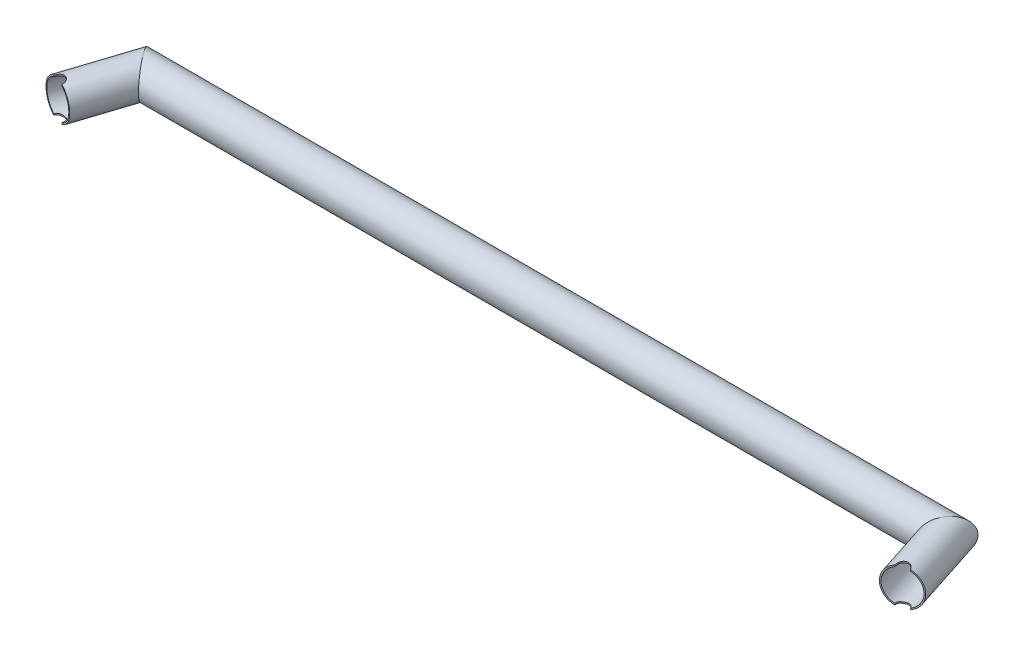
from build123d import *

# Parameters (mm, degrees)
SKETCH2_R               = 10.5
SKETCH2_R_2             = 9.75
CUT_EXTRUDE1_DEPTH      = 255.202518271
CUT_EXTRUDE1_DEPTH_BACK = 255.202518271
SKETCH3_R               = 3.5


with BuildPart() as part:
    # Sweep1: sweep along a path in Sketch1
    with BuildLine(Plane(origin=(0, 0, 0), x_dir=(1, 0, 0), z_dir=(0, 1, 0))) as sweep1_path:
        Line((-240.81, -36.88), (-228.826961603, 0))
        Line((-228.826961603, 0), (228.826961603, 0))
        Line((228.826961603, 0), (240.81, -36.88))
    # Sketch2 → Sweep1 (sweep)
    with BuildSketch(Plane(origin=(-240.81, 0, 36.88), x_dir=(0.9510565162951523, 0, 0.3090169943749515), z_dir=(-0.3090169943749515, 0, 0.9510565162951523))):
        Circle(SKETCH2_R)
        Circle(SKETCH2_R_2, mode=Mode.SUBTRACT)
    sweep(path=sweep1_path.line, transition=Transition.RIGHT)

    # Sketch3 → Cut-Extrude1 (cut, two sides: drawn at the far end of the back side and taken through both)
    with BuildSketch(Plane(origin=(0, 0, 0), x_dir=(1, 0, 0), z_dir=(0, 1, 0)).offset(-CUT_EXTRUDE1_DEPTH_BACK)):
        with Locations((240.81, -36.88)):
            Circle(SKETCH3_R)
        with Locations((-240.81, -36.88)):
            Circle(SKETCH3_R)
    extrude(amount=CUT_EXTRUDE1_DEPTH + CUT_EXTRUDE1_DEPTH_BACK, mode=Mode.SUBTRACT)


solid = part.part
